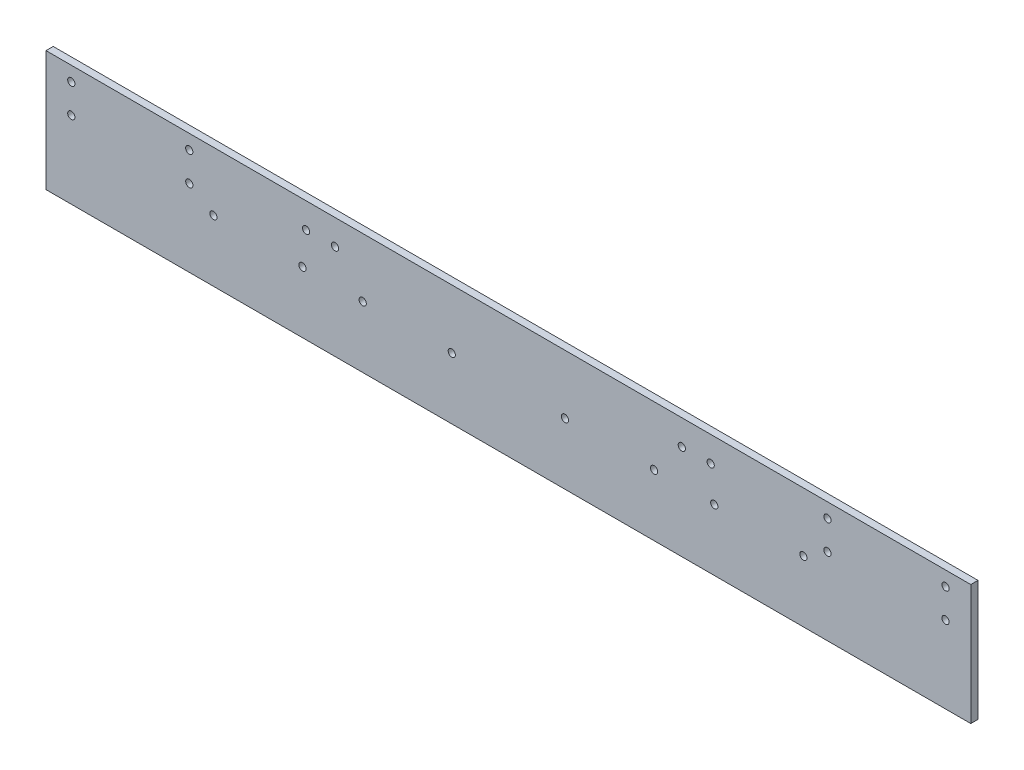
from build123d import *

# Parameters (mm, degrees)
SKETCH_1_W          = 384
SKETCH_1_H          = 50
EXTRUDE_1_DEPTH     = 3
SKETCH_2_R          = 1.5
CUT_EXTRUDE_1_DEPTH = 388.253147179


with BuildPart() as part:
    # 草图1 → 凸台-拉伸1 (new body)
    with BuildSketch(Plane.XY):
        with Locations((192, 25)):
            Rectangle(SKETCH_1_W, SKETCH_1_H)
    extrude(amount=EXTRUDE_1_DEPTH)

    # 草图2 → 切除-拉伸1 (cut, through all)
    with BuildSketch(Plane.XY.offset(3)):
        with Locations((264, 39.5)):
            Circle(SKETCH_2_R)
        with Locations((276, 39.5)):
            Circle(SKETCH_2_R)
        with Locations((120, 39.5)):
            Circle(SKETCH_2_R)
        with Locations((108, 39.5)):
            Circle(SKETCH_2_R)
        with Locations((215.5, 25.5)):
            Circle(SKETCH_2_R)
        with Locations((252.5, 25.5)):
            Circle(SKETCH_2_R)
        with Locations((277.5, 25.5)):
            Circle(SKETCH_2_R)
        with Locations((314.5, 25.5)):
            Circle(SKETCH_2_R)
        with Locations(Location((69.5, 25.5, 0), (0, 0, 180))):
            Circle(SKETCH_2_R)
        with Locations(Location((106.5, 25.5, 0), (0, 0, 180))):
            Circle(SKETCH_2_R)
        with Locations(Location((131.5, 25.5, 0), (0, 0, 180))):
            Circle(SKETCH_2_R)
        with Locations(Location((168.5, 25.5, 0), (0, 0, 180))):
            Circle(SKETCH_2_R)
        with Locations((373.5, 44)):
            Circle(SKETCH_2_R)
        with Locations((373.5, 32)):
            Circle(SKETCH_2_R)
        with Locations((324.5, 44)):
            Circle(SKETCH_2_R)
        with Locations((324.5, 32)):
            Circle(SKETCH_2_R)
        with Locations(Location((59.5, 44, 0), (0, 0, 180))):
            Circle(SKETCH_2_R)
        with Locations(Location((10.5, 44, 0), (0, 0, 180))):
            Circle(SKETCH_2_R)
        with Locations(Location((10.5, 32, 0), (0, 0, 180))):
            Circle(SKETCH_2_R)
        with Locations(Location((59.5, 32, 0), (0, 0, 180))):
            Circle(SKETCH_2_R)
    extrude(amount=-CUT_EXTRUDE_1_DEPTH, mode=Mode.SUBTRACT)


solid = part.part
